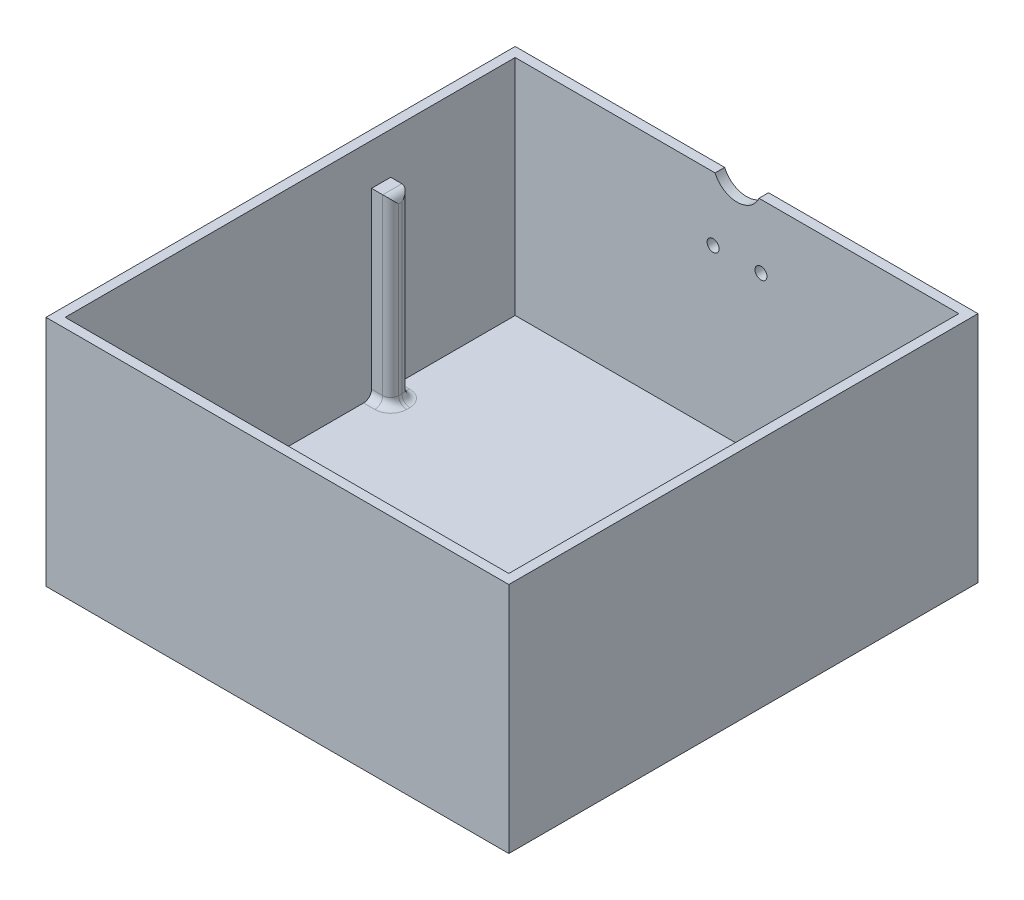
from build123d import *

# Parameters (mm, degrees)
SKETCH1_W           = 116
SKETCH1_H           = 117.6
BOSS_EXTRUDE1_DEPTH = 2.4
SKETCH2_W           = 116
SKETCH2_H           = 117.6
SKETCH2_W_2         = 111.2
SKETCH2_H_2         = 112.8
BOSS_EXTRUDE2_DEPTH = 56
SKETCH3_R           = 1.5
CUT_EXTRUDE1_DEPTH  = 10
SKETCH7_W           = 4.8
SKETCH7_H           = 4.8
BOSS_EXTRUDE4_DEPTH = 45.6
FILLET2_R           = 2
SKETCH8_R           = 6
CUT_EXTRUDE2_DEPTH  = 10


with BuildPart() as part:
    # Sketch1 → Boss-Extrude1 (new body)
    with BuildSketch(Plane(origin=(0, 0, 0), x_dir=(1, 0, 0), z_dir=(0, 1, 0))):
        with Locations((58, -58.8)):
            Rectangle(SKETCH1_W, SKETCH1_H)
    extrude(amount=BOSS_EXTRUDE1_DEPTH)

    # Sketch2 → Boss-Extrude2 (add)
    with BuildSketch(Plane(origin=(0, 2.4, 0), x_dir=(1, 0, 0), z_dir=(0, 1, 0))):
        with Locations((58, -58.8)):
            Rectangle(SKETCH2_W, SKETCH2_H)
        with Locations((58, -58.8)):
            Rectangle(SKETCH2_W_2, SKETCH2_H_2, mode=Mode.SUBTRACT)
    extrude(amount=BOSS_EXTRUDE2_DEPTH)

    # Sketch3 → Cut-Extrude1 (cut)
    with BuildSketch(Plane(origin=(0, 0, 0), x_dir=(-1, 0, 0), z_dir=(0, 0, -1))):
        with Locations((-64, 42.4)):
            Circle(SKETCH3_R)
        with Locations((-52, 42.4)):
            Circle(SKETCH3_R)
    extrude(amount=-CUT_EXTRUDE1_DEPTH, mode=Mode.SUBTRACT)

    # Sketch7 → Boss-Extrude4 (add)
    with BuildSketch(Plane(origin=(0, 2.4, 0), x_dir=(1, 0, 0), z_dir=(0, 1, 0))):
        with Locations((4.8, -112.8)):
            Rectangle(SKETCH7_W, SKETCH7_H)
        with Locations((4.8, -36)):
            Rectangle(SKETCH7_W, SKETCH7_H)
        with Locations((111.2, -112.8)):
            Rectangle(SKETCH7_W, SKETCH7_H)
        with Locations((111.2, -36)):
            Rectangle(SKETCH7_W, SKETCH7_H)
    extrude(amount=BOSS_EXTRUDE4_DEPTH)

    # Fillet2
    fillet2_edges = [part.edges().sort_by_distance(p)[0] for p in [
        (4.8, 2.4, 38.4),
        (4.8, 2.4, 33.6),
        (111.2, 2.4, 33.6),
        (111.2, 2.4, 38.4),
        (7.2, 25.2, 38.4),
        (7.2, 48, 36),
        (7.2, 25.2, 33.6),
        (7.2, 2.4, 36),
        (108.8, 25.2, 33.6),
        (108.8, 48, 36),
        (108.8, 25.2, 38.4),
        (108.8, 2.4, 36),
        (7.2, 25.2, 110.4),
        (108.8, 25.2, 110.4),
        (4.8, 2.4, 110.4),
        (7.2, 2.4, 112.8),
        (108.8, 2.4, 112.8),
        (111.2, 2.4, 110.4),
    ]]
    fillet(fillet2_edges, radius=FILLET2_R)

    # Sketch8 → Cut-Extrude2 (cut)
    with BuildSketch(Plane(origin=(0, 0, 0), x_dir=(-1, 0, 0), z_dir=(0, 0, -1))):
        with Locations((-58, 60.8)):
            Circle(SKETCH8_R)
    extrude(amount=-CUT_EXTRUDE2_DEPTH, mode=Mode.SUBTRACT)


solid = part.part
